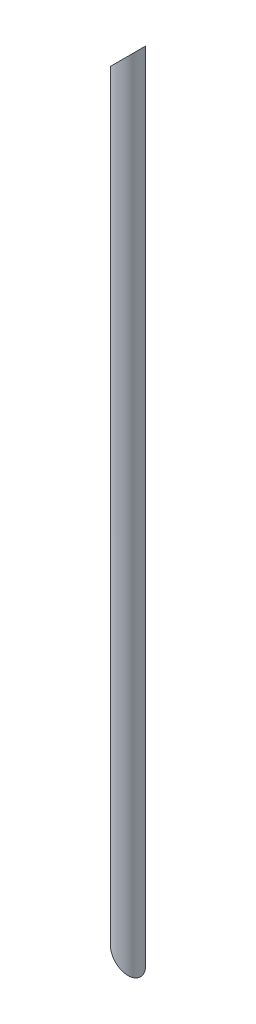
from build123d import *

# Parameters (mm, degrees)
ESBO_O2_W                  = 39.3
ESBO_O2_H                  = 2530.71
CORTE_EXTRUS_O1_DEPTH      = 2532.320225515
CORTE_EXTRUS_O1_DEPTH_BACK = 2532.320225515
ESBO_O9_R                  = 35.87378144
CORTE_EXTRUS_O6_DEPTH      = 2532.320225515


with BuildPart() as part:
    # Esboço2 → Revolução2 (revolve)
    with BuildSketch(Plane.XY):
        with Locations((19.65, 1265.355)):
            Rectangle(ESBO_O2_W, ESBO_O2_H)
    revolve(axis=Axis((0, 0, 0), (0, 1, 0)))

    # Esboço3 → Corte-extrusão1 (cut, two sides: drawn at the far end of the back side and taken through both)
    with BuildSketch(Plane.XY.offset(-CORTE_EXTRUS_O1_DEPTH_BACK)):
        Polygon((-39.3, 2530.71), (39.3, 2530.71), (-39.3, 2452.11), align=None)
        Polygon((39.3, 0), (-39.3, 78.6), (-39.3, 0), align=None)
    extrude(amount=CORTE_EXTRUS_O1_DEPTH + CORTE_EXTRUS_O1_DEPTH_BACK, mode=Mode.SUBTRACT)

    # Esboço9 → Corte-extrusão6 (cut, through all)
    with BuildSketch(Plane(origin=(0, 0, 0), x_dir=(1, 0, 0), z_dir=(0, 1, 0))):
        Circle(ESBO_O9_R)
    extrude(amount=CORTE_EXTRUS_O6_DEPTH, mode=Mode.SUBTRACT)


solid = part.part
